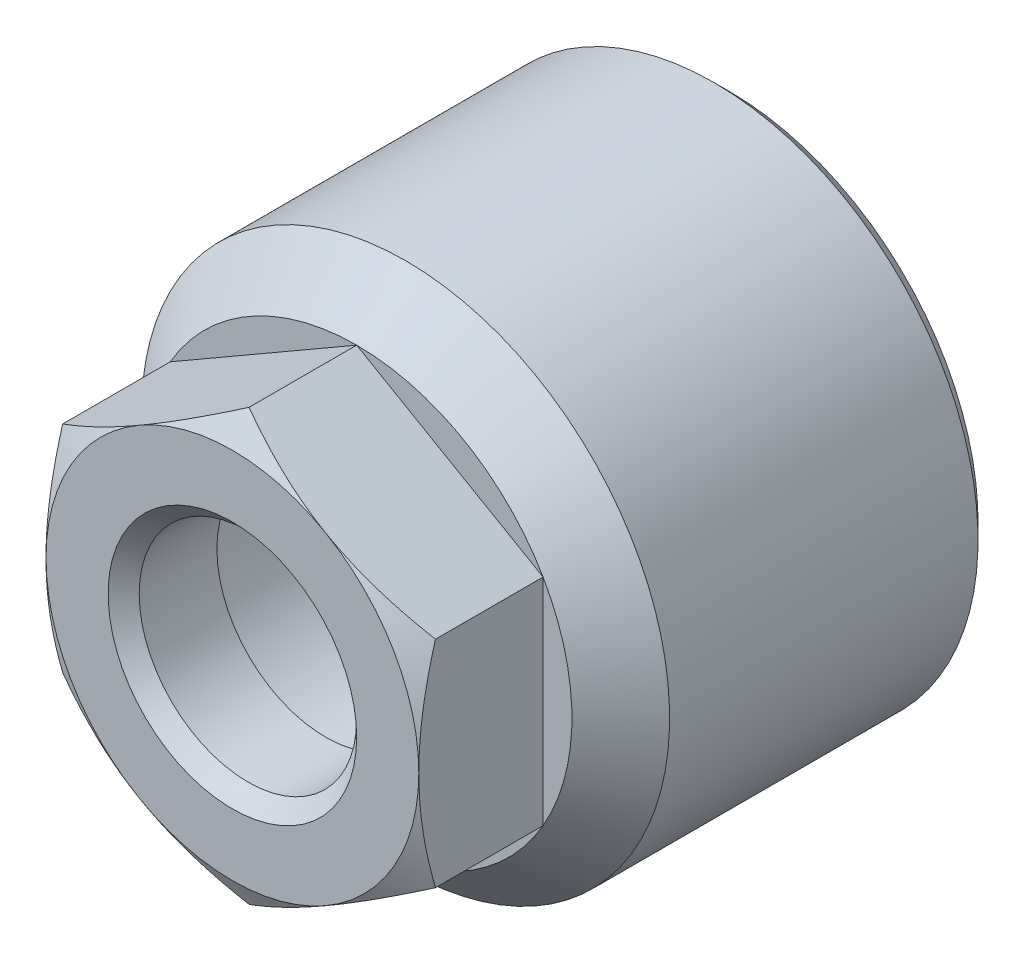
from build123d import *

# Parameters (mm, degrees)
EXTRUDE_1_DEPTH         = 8
SKETCH_3_OUTSIDE_W      = 189.666
SKETCH_3_OUTSIDE_H      = 189.666
SKETCH_3_OUTSIDE_R      = 12
CUT_EXTRUDE_1_DEPTH     = 41.024992192
CUT_EXTRUDE_1_DRAFT     = -60
HOLE_WIZARD_M30_1_D     = 26.5
HOLE_WIZARD_M30_1_DEPTH = 10
CHAMFER_1_SIZE          = 1
CHAMFER_2_SIZE          = 1


with BuildPart() as part:
    # 草图1 → 凸台-拉伸1 (new body)
    with BuildSketch(Plane.XY):
        Polygon((0, 13.856406461), (-12, 6.92820323), (-12, -6.92820323), (0, -13.856406461), (12, -6.92820323), (12, 6.92820323), align=None)
    extrude(amount=-EXTRUDE_1_DEPTH)

    # 草图2 → 旋转1 (revolve)
    with BuildSketch(Plane(origin=(0, 0, 0), x_dir=(0, 0, -1), z_dir=(1, 0, 0))):
        Polygon((8, 0), (8, 13.856406461), (11.143593539, 17), (32, 17), (32, 0), align=None)
    revolve(axis=Axis((0, 0, -32), (0, 0, 1)))


with BuildPart() as cut_extrude_1_tool:
    # 草图3 outside → 切除-拉伸1 (with draft: the straight prism first)
    with BuildSketch(Plane.XY):
        Rectangle(SKETCH_3_OUTSIDE_W, SKETCH_3_OUTSIDE_H)
        Circle(SKETCH_3_OUTSIDE_R, mode=Mode.SUBTRACT)
    extrude(amount=-CUT_EXTRUDE_1_DEPTH)
    # 切除-拉伸1: the draft: its side faces are tilted about the plane it starts from
    cut_extrude_1_sides = [cut_extrude_1_tool.faces().sort_by_distance(p)[0] for p in [
        (0, -94.833, -20.512496096),
        (94.833, 0, -20.512496096),
        (0, 94.833, -20.512496096),
        (-94.833, 0, -20.512496096),
        (-12, 0, -20.512496096),
    ]]
    draft(cut_extrude_1_sides, Plane.XY, CUT_EXTRUDE_1_DRAFT)


with BuildPart() as part_1:
    add(part.part)

    # 切除-拉伸1: cut by cut_extrude_1_tool
    add(cut_extrude_1_tool.part, mode=Mode.SUBTRACT)

    # 草图4 → 切除-旋转1 (revolve, cut)
    with BuildSketch(Plane(origin=(0, 0, 0), x_dir=(0, 0, -1), z_dir=(1, 0, 0)), mode=Mode.PRIVATE) as cut_revolve_1_sk:
        Polygon((0, 0), (0, -7), (6, -7), (6, -9), (14, -9), (14, -14), (15, -14), (15, -15), (22, -15), (22, 0), align=None)
    revolve(cut_revolve_1_sk.sketch.rotate(Axis((0, 0, -22), (0, 0, 1)), 270), axis=Axis((0, 0, -22), (0, 0, 1)), mode=Mode.SUBTRACT)

    # M30 螺纹孔1
    with Locations(Plane(origin=(0, 0, -32), x_dir=(-1, 0, 0), z_dir=(0, 0, -1))):
        with Locations((0, 0)):
            Hole(HOLE_WIZARD_M30_1_D / 2, depth=HOLE_WIZARD_M30_1_DEPTH)

    # 倒角1
    chamfer_1_edges = [part_1.edges().sort_by_distance(p)[0] for p in [
        (0, -17, -32),
    ]]
    chamfer(chamfer_1_edges, length=CHAMFER_1_SIZE)

    # 倒角2
    chamfer_2_edges = [part_1.edges().sort_by_distance(p)[0] for p in [
        (7, 0, 0),
        (9, 0, -14),
    ]]
    chamfer(chamfer_2_edges, length=CHAMFER_2_SIZE)


solid = part_1.part
